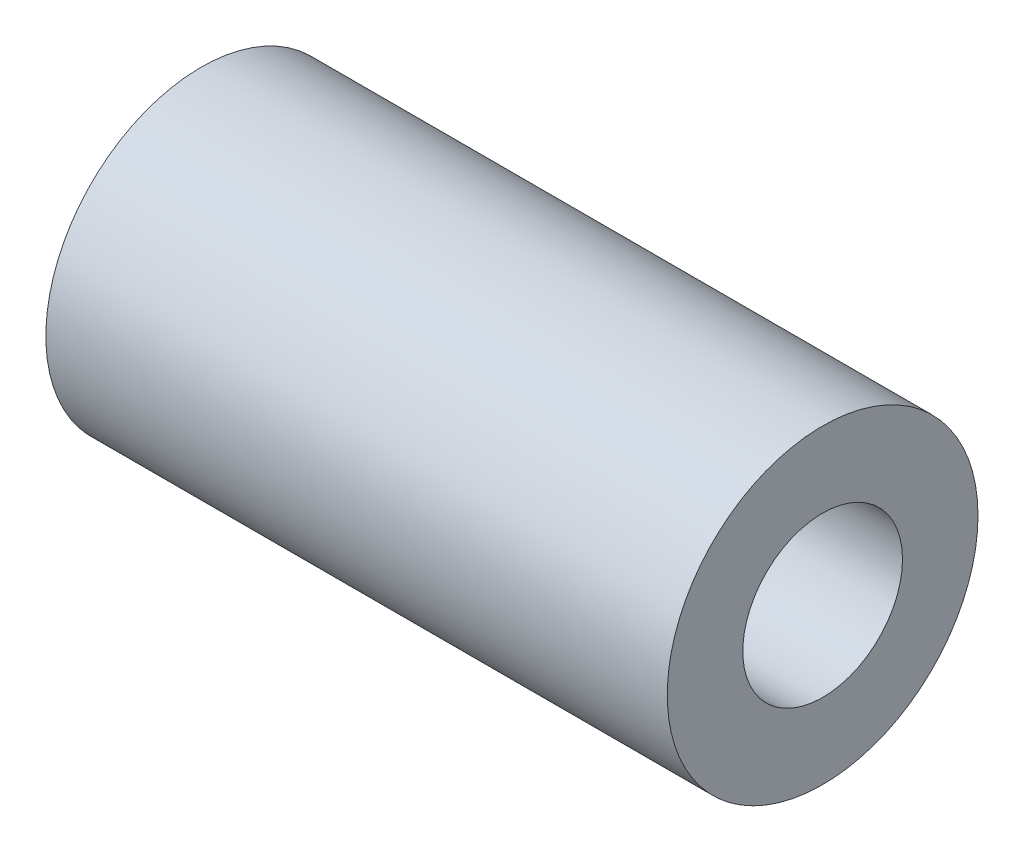
from build123d import *

# Parameters (mm, degrees)
SKETCH1_R           = 6.35
SKETCH1_R_2         = 3.2639
BOSS_EXTRUDE1_DEPTH = 25.4


with BuildPart() as part:
    # Sketch1 → Boss-Extrude1 (new body)
    with BuildSketch(Plane(origin=(0, 0, 0), x_dir=(0, 0, -1), z_dir=(1, 0, 0))):
        Circle(SKETCH1_R)
        Circle(SKETCH1_R_2, mode=Mode.SUBTRACT)
    extrude(amount=BOSS_EXTRUDE1_DEPTH)


solid = part.part
